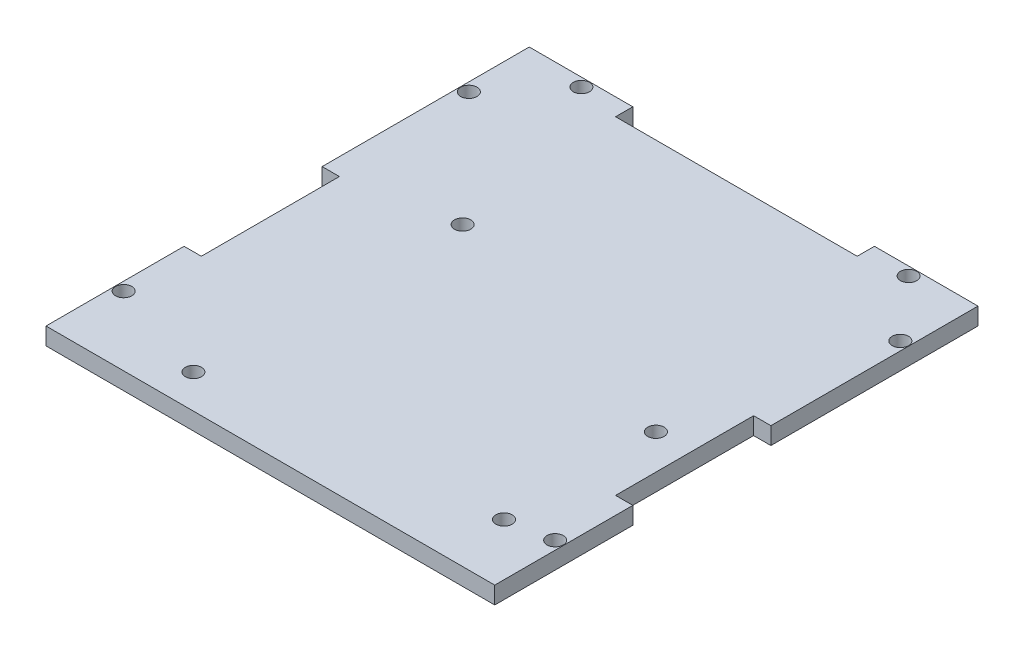
from build123d import *

# Parameters (mm, degrees)
BOSS_EXTRUDE1_DEPTH = 3.175
SKETCH2_R           = 1.5
SKETCH2_R_2         = 1.500000048
CUT_EXTRUDE1_DEPTH  = 99.065877093
SKETCH4_R           = 1.5
CUT_EXTRUDE3_DEPTH  = 99.065877093
SKETCH5_W           = 82.55
SKETCH5_H           = 60.325
CUT_EXTRUDE4_DEPTH  = 99.065877093
SKETCH6_R           = 1.5
CUT_EXTRUDE5_DEPTH  = 99.065877093


with BuildPart() as part:
    # Sketch1 → Boss-Extrude1 (new body)
    with BuildSketch(Plane(origin=(0, 0, 0), x_dir=(1, 0, 0), z_dir=(0, 1, 0))):
        Polygon((-41.275, 0), (-36.368301991, -11.713851401), (-33.466950324, -10.424361771), (-17.857958519, -45.544593333), (-20.759310186, -46.834082962), (-15.601351667, -58.43948963), (-12.7, -60.325), (-5.08, -60.325), (-5.08, -57.15), (5.08, -57.15), (5.08, -60.325), (12.7, -60.325), (15.601351667, -58.43948963), (20.759310186, -46.834082962), (17.857958519, -45.544593333), (33.466950324, -10.424361771), (36.368301991, -11.713851401), (41.275, 0), (41.275, 25.4), (38.1, 25.4), (38.1, 50.8), (41.275, 50.8), (41.275, 88.9), (22.225, 88.9), (22.225, 85.725), (10.205057544, 85.725), (-10.205057544, 85.725), (-22.225, 85.725), (-22.225, 88.9), (-41.275, 88.9), (-41.275, 50.8), (-38.1, 50.8), (-38.1, 25.4), (-41.275, 25.4), align=None)
    extrude(amount=BOSS_EXTRUDE1_DEPTH)

    # Sketch2 → Cut-Extrude1 (cut, through all)
    with BuildSketch(Plane(origin=(0, 0, 0), x_dir=(-1, 0, 0), z_dir=(0, -1, 0))):
        with Locations(Location((39.6875, 76.2, 0), (0, 0, 90))):
            Circle(SKETCH2_R)
        with Locations(Location((-8.89, -58.7375, 0), (0, 0, 270))):
            Circle(SKETCH2_R_2)
        with Locations(Location((39.6875, 12.7, 0), (0, 0, 90))):
            Circle(SKETCH2_R_2)
        with Locations((37.496605417, -5.266403252)):
            Circle(SKETCH2_R_2)
        with Locations(Location((16.729655093, -51.992041481, 0), (0, 0, 90))):
            Circle(SKETCH2_R_2)
        with Locations(Location((8.89, -58.7375, 0), (0, 0, 90))):
            Circle(SKETCH2_R_2)
        with Locations(Location((-16.729655093, -51.992041481, 0), (0, 0, 270))):
            Circle(SKETCH2_R_2)
        with Locations((-37.496605417, -5.266403252)):
            Circle(SKETCH2_R_2)
        with Locations(Location((-39.6875, 12.7, 0), (0, 0, 270))):
            Circle(SKETCH2_R_2)
        with Locations(Location((-39.6875, 76.2, 0), (0, 0, 270))):
            Circle(SKETCH2_R)
    extrude(amount=-CUT_EXTRUDE1_DEPTH, mode=Mode.SUBTRACT)

    # Sketch4 → Cut-Extrude3 (cut, through all)
    with BuildSketch(Plane(origin=(0, 3.175, 0), x_dir=(1, 0, 0), z_dir=(0, 1, 0))):
        with Locations(Location((31.681488655, 11.305, 0), (0, 0, 270))):
            Circle(SKETCH4_R)
        with Locations(Location((31.681488655, 39.245, 0), (0, 0, 270))):
            Circle(SKETCH4_R)
        with Locations(Location((-20.388511345, 6.225, 0), (0, 0, 270))):
            Circle(SKETCH4_R)
        with Locations(Location((-19.118511345, 54.485, 0), (0, 0, 270))):
            Circle(SKETCH4_R)
    extrude(amount=-CUT_EXTRUDE3_DEPTH, mode=Mode.SUBTRACT)

    # Sketch5 → Cut-Extrude4 (cut, through all)
    with BuildSketch(Plane(origin=(0, 3.175, 0), x_dir=(1, 0, 0), z_dir=(0, 1, 0))):
        with Locations((0, -30.1625)):
            Rectangle(SKETCH5_W, SKETCH5_H)
    extrude(amount=-CUT_EXTRUDE4_DEPTH, mode=Mode.SUBTRACT)

    # Sketch6 → Cut-Extrude5 (cut, through all)
    with BuildSketch(Plane(origin=(0, 3.175, 0), x_dir=(1, 0, 0), z_dir=(0, 1, 0))):
        with Locations(Location((-30.099, 87.3125, 0), (0, 0, 270))):
            Circle(SKETCH6_R)
        with Locations(Location((30.099, 87.3125, 0), (0, 0, 270))):
            Circle(SKETCH6_R)
    extrude(amount=-CUT_EXTRUDE5_DEPTH, mode=Mode.SUBTRACT)


solid = part.part
